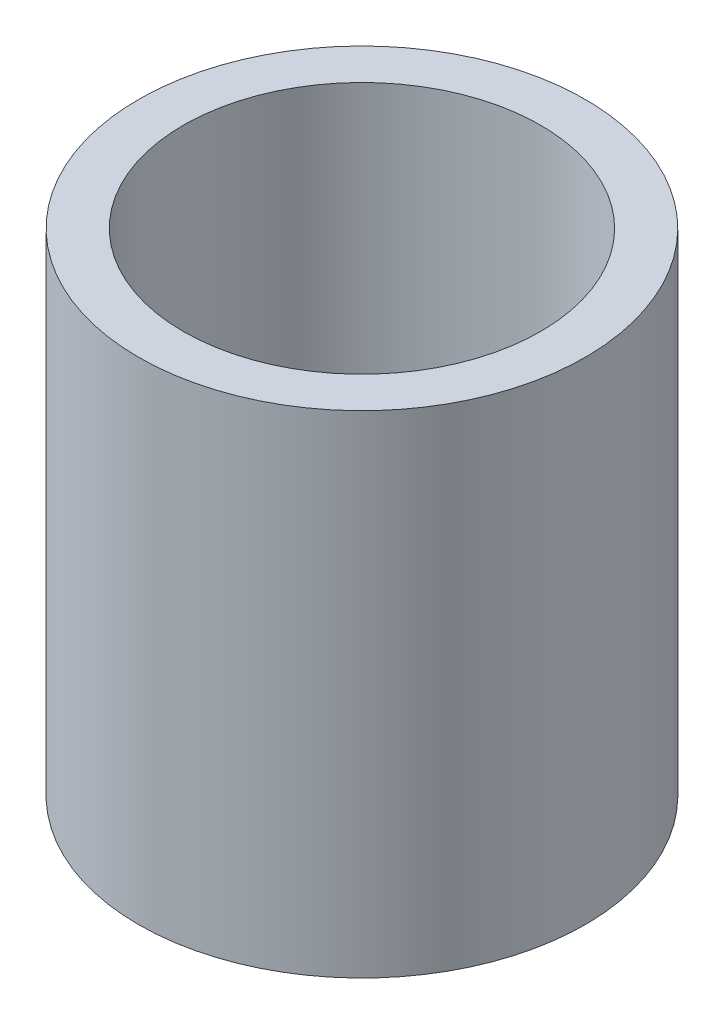
from build123d import *

# Parameters (mm, degrees)
SKETCH1_R           = 15.875
SKETCH1_R_2         = 12.7
BOSS_EXTRUDE1_DEPTH = 34.925


with BuildPart() as part:
    # Sketch1 → Boss-Extrude1 (new body)
    with BuildSketch(Plane(origin=(0, 0, 0), x_dir=(1, 0, 0), z_dir=(0, 1, 0))):
        with Locations(Location((0, 0, 0), (0, 0, 270))):
            Circle(SKETCH1_R)
        with Locations(Location((0, 0, 0), (0, 0, 270))):
            Circle(SKETCH1_R_2, mode=Mode.SUBTRACT)
    extrude(amount=BOSS_EXTRUDE1_DEPTH)


solid = part.part
